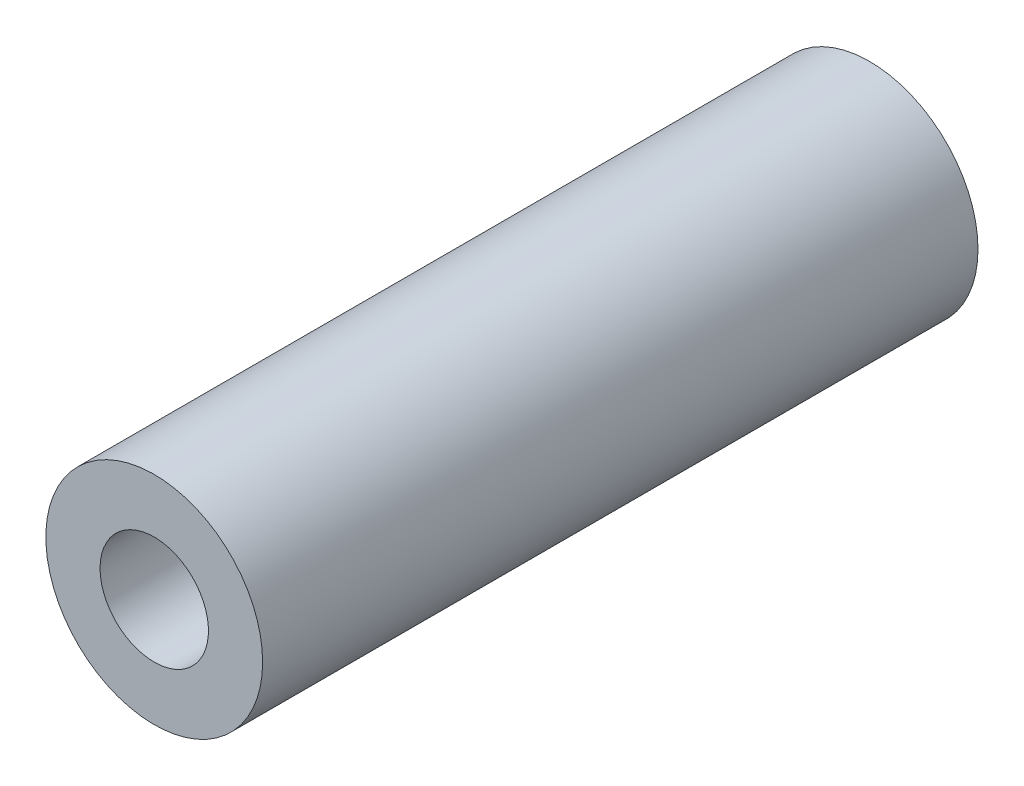
from build123d import *

# Parameters (mm, degrees)
SKETCH1_R           = 5
BOSS_EXTRUDE1_DEPTH = 33
SKETCH2_R           = 2.5
CUT_EXTRUDE1_DEPTH  = 34.749074061


with BuildPart() as part:
    # Sketch1 → Boss-Extrude1 (new body)
    with BuildSketch(Plane.XY):
        Circle(SKETCH1_R)
    extrude(amount=BOSS_EXTRUDE1_DEPTH)

    # Sketch2 → Cut-Extrude1 (cut, through all)
    with BuildSketch(Plane(origin=(0, 0, 0), x_dir=(-1, 0, 0), z_dir=(0, 0, -1))):
        Circle(SKETCH2_R)
    extrude(amount=-CUT_EXTRUDE1_DEPTH, mode=Mode.SUBTRACT)


solid = part.part
